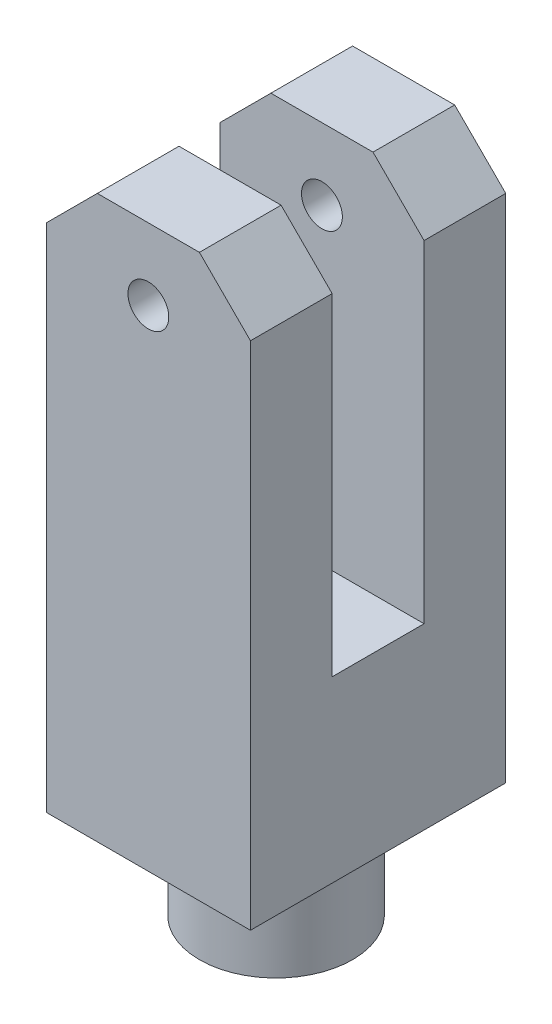
from build123d import *

# Parameters (mm, degrees)
SKETCH1_R           = 15
BOSS_EXTRUDE1_DEPTH = 20
SKETCH2_W           = 40
SKETCH2_H           = 50
BOSS_EXTRUDE2_DEPTH = 110
SKETCH3_W           = 18
SKETCH3_H           = 150
CUT_EXTRUDE1_DEPTH  = 139.293166859
SKETCH4_R           = 4
CUT_EXTRUDE2_DEPTH  = 141.712472795
CHAMFER1_SIZE       = 10


with BuildPart() as part:
    # Sketch1 → Boss-Extrude1 (new body)
    with BuildSketch(Plane(origin=(0, 0, 0), x_dir=(1, 0, 0), z_dir=(0, 1, 0))):
        with Locations(Location((0, 0, 0), (0, 0, 270))):
            Circle(SKETCH1_R)
    extrude(amount=BOSS_EXTRUDE1_DEPTH)

    # Sketch2 → Boss-Extrude2 (add)
    with BuildSketch(Plane(origin=(0, 20, 0), x_dir=(1, 0, 0), z_dir=(0, 1, 0))):
        Rectangle(SKETCH2_W, SKETCH2_H)
    extrude(amount=BOSS_EXTRUDE2_DEPTH)

    # Sketch3 → Cut-Extrude1 (cut, through all)
    with BuildSketch(Plane(origin=(20, 0, 0), x_dir=(0, 0, -1), z_dir=(1, 0, 0))):
        with Locations((0, 130)):
            Rectangle(SKETCH3_W, SKETCH3_H)
    extrude(amount=-CUT_EXTRUDE1_DEPTH, mode=Mode.SUBTRACT)

    # Sketch4 → Cut-Extrude2 (cut, through all)
    with BuildSketch(Plane(origin=(0, 0, -25), x_dir=(-1, 0, 0), z_dir=(0, 0, -1))):
        with Locations((0, 116)):
            Circle(SKETCH4_R)
    extrude(amount=-CUT_EXTRUDE2_DEPTH, mode=Mode.SUBTRACT)

    # Chamfer1
    chamfer1_edges = [part.edges().sort_by_distance(p)[0] for p in [
        (20, 130, -17),
        (-20, 130, 17),
        (20, 130, 17),
        (-20, 130, -17),
    ]]
    chamfer(chamfer1_edges, length=CHAMFER1_SIZE)


solid = part.part
